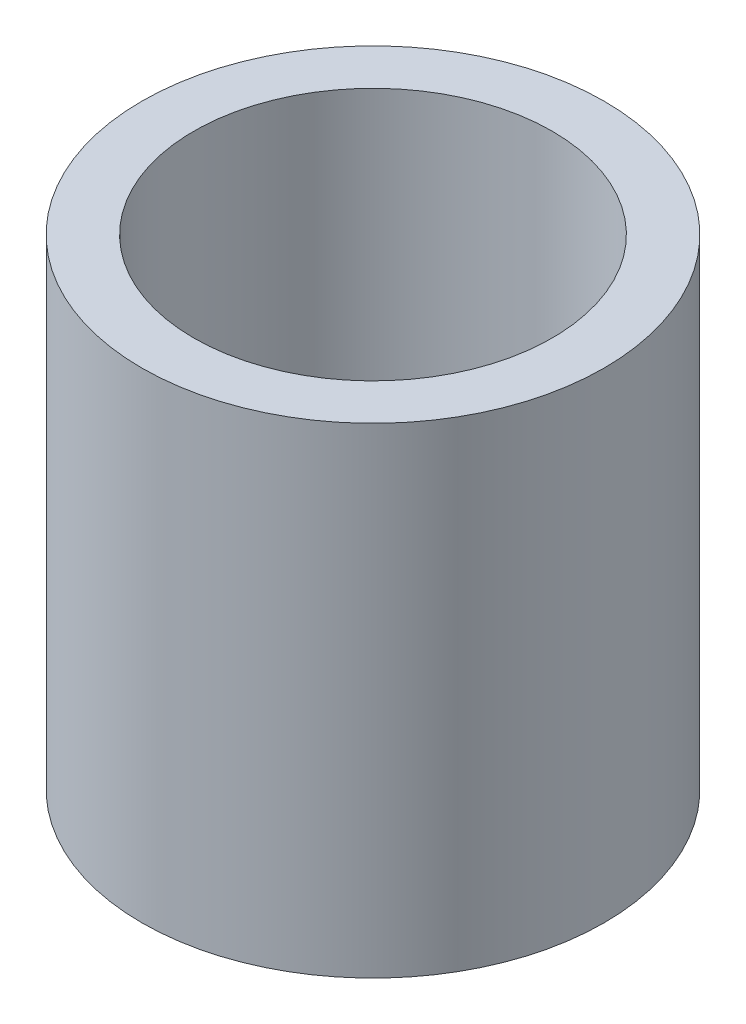
from build123d import *

# Parameters (mm, degrees)
SKETCH1_R           = 8.9
SKETCH1_R_2         = 6.9
BOSS_EXTRUDE1_DEPTH = 18.5


with BuildPart() as part:
    # Sketch1 → Boss-Extrude1 (new body)
    with BuildSketch(Plane(origin=(0, 0, 0), x_dir=(1, 0, 0), z_dir=(0, 1, 0))):
        with Locations(Location((0, 0, 0), (0, 0, 270))):
            Circle(SKETCH1_R)
        with Locations(Location((0, 0, 0), (0, 0, 270))):
            Circle(SKETCH1_R_2, mode=Mode.SUBTRACT)
    extrude(amount=BOSS_EXTRUDE1_DEPTH)


solid = part.part
